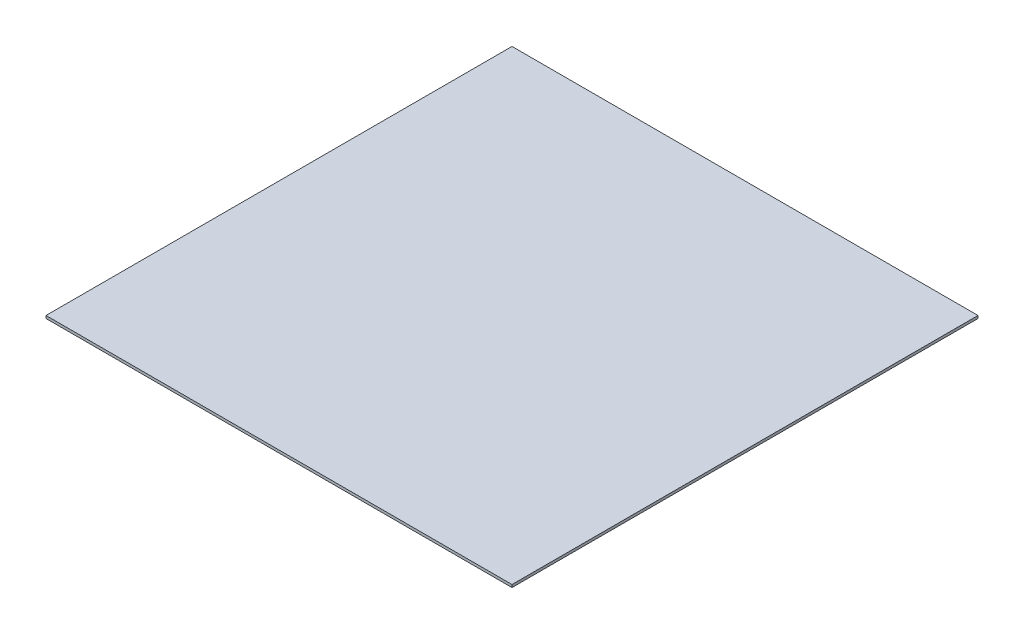
from build123d import *

# Parameters (mm, degrees)
SKETCH1_W           = 22.352
SKETCH1_H           = 22.352
BOSS_EXTRUDE1_DEPTH = 0.127


with BuildPart() as part:
    # Sketch1 → Boss-Extrude1 (new body)
    with BuildSketch(Plane(origin=(0, 0, 0), x_dir=(1, 0, 0), z_dir=(0, 1, 0))):
        with Locations((11.176, 11.176)):
            Rectangle(SKETCH1_W, SKETCH1_H)
    extrude(amount=BOSS_EXTRUDE1_DEPTH)


solid = part.part
